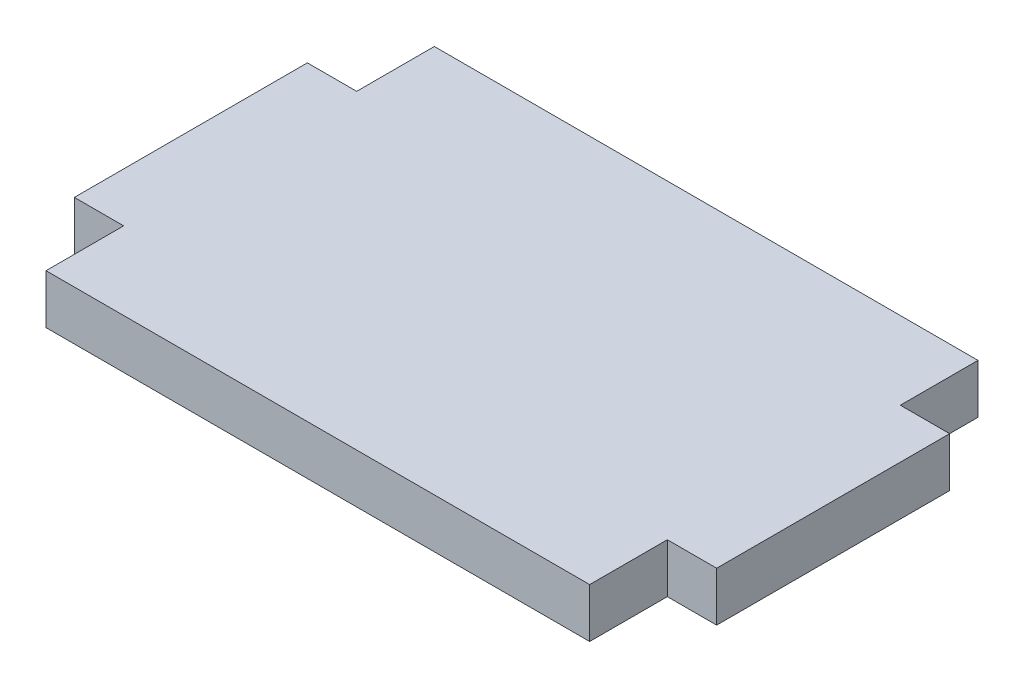
from build123d import *

# Parameters (mm, degrees)
BODY_DEPTH = 6.35


with BuildPart() as part:
    # Sketch1 → Body (new body)
    with BuildSketch(Plane(origin=(0, 0, 0), x_dir=(1, 0, 0), z_dir=(0, 1, 0))):
        Polygon((-49.076012748, 5.505075896), (-42.726012748, 5.505075896), (-42.726012748, 15.505075896), (27.273987252, 15.505075896), (27.273987252, 5.505075896), (33.623987252, 5.505075896), (33.623987252, -24.494924104), (27.273987252, -24.494924104), (27.273987252, -34.494924104), (-42.726012748, -34.494924104), (-42.726012748, -24.494924104), (-49.076012748, -24.494924104), align=None)
    extrude(amount=BODY_DEPTH)


solid = part.part
